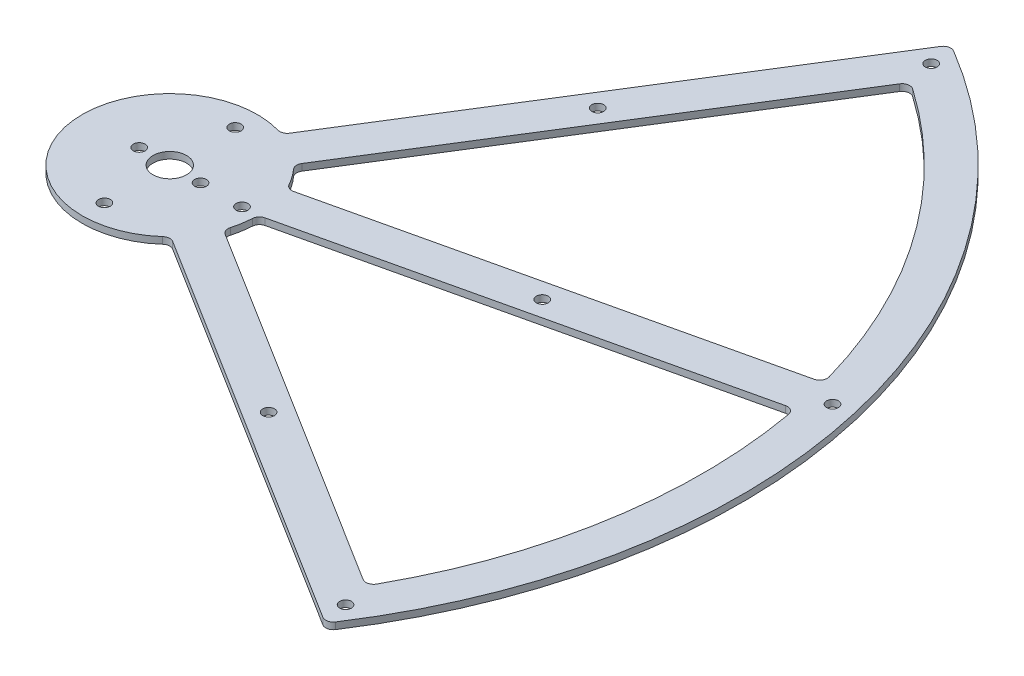
from build123d import *

# Parameters (mm, degrees)
BOSS_EXTRUDE1_DEPTH  = 1.75
MOUNTING_HOLES_REACH = 199.898
SKETCH2_R            = 4.4
SKETCH2_R_2          = 1.55


with BuildPart() as part:
    # Sketch1 → Boss-Extrude1 (new body)
    with BuildSketch(Plane(origin=(0, 0, 0), x_dir=(1, 0, 0), z_dir=(0, 1, 0))):
        with BuildLine():
            Line((8.477821861, 23.002750629), (74.17169656, 128.134926657))
            ThreePointArc((74.17169656, 128.134926657), (75.398161995, 129.019168104), (76.893033195, 128.792319049))
            ThreePointArc((76.893033195, 128.792319049), (146.155509718, 33.742658152), (125.569837037, -82.050082429))
            ThreePointArc((125.569837037, -82.050082429), (124.325699782, -82.909281411), (122.835734015, -82.652177522))
            Line((122.835734015, -82.652177522), (17.703557987, -16.958302822))
            ThreePointArc((17.703557987, -16.958302822), (16.473932566, -16.661618944), (15.312221901, -17.162047094))
            ThreePointArc((15.312221901, -17.162047094), (-22.41051149, -5.17387425), (6.239187615, 22.137582025))
            ThreePointArc((6.239187615, 22.137582025), (7.502699505, 22.197060619), (8.477821861, 23.002750629))
        make_face()
        with BuildLine():
            Line((22.260126283, 10.270675628), (133.165216263, 35.875133138))
            ThreePointArc((133.165216263, 35.875133138), (134.43775302, 36.807406666), (134.638724504, 38.372045344))
            ThreePointArc((134.638724504, 38.372045344), (113.97617257, 81.2984138), (80.115562712, 114.810699028))
            ThreePointArc((80.115562712, 114.810699028), (78.570737863, 115.130073284), (77.274958481, 114.230384713))
            Line((77.274958481, 114.230384713), (16.958302822, 17.703557987))
            ThreePointArc((16.958302822, 17.703557987), (16.661618944, 16.473932566), (17.162047094, 15.312221901))
            ThreePointArc((17.162047094, 15.312221901), (18.724656922, 13.356167981), (20.06540624, 11.241862497))
            ThreePointArc((20.06540624, 11.241862497), (21.000901784, 10.390482389), (22.260126283, 10.270675628))
        make_face(mode=Mode.SUBTRACT)
        with BuildLine():
            Line((24.509636827, 0.52697498), (135.414726806, 26.131432491))
            ThreePointArc((135.414726806, 26.131432491), (136.967157083, 25.851353992), (137.833681508, 24.533166163))
            ThreePointArc((137.833681508, 24.533166163), (138.079984215, -23.10666482), (122.337088578, -68.070821636))
            ThreePointArc((122.337088578, -68.070821636), (121.08861366, -69.035079956), (119.529577356, -68.794477519))
            Line((119.529577356, -68.794477519), (23.002750629, -8.477821861))
            ThreePointArc((23.002750629, -8.477821861), (22.197060619, -7.502699505), (22.137582025, -6.239187615))
            ThreePointArc((22.137582025, -6.239187615), (22.684568835, -3.796094935), (22.96277582, -1.308023937))
            ThreePointArc((22.96277582, -1.308023937), (23.430373171, -0.132714311), (24.509636827, 0.52697498))
        make_face(mode=Mode.SUBTRACT)
    extrude(amount=BOSS_EXTRUDE1_DEPTH)

    # Sketch2 → Mounting_Holes (cut, up to next)
    with BuildSketch(Plane(origin=(0, 1.75, 0), x_dir=(1, 0, 0), z_dir=(0, 1, 0)), mode=Mode.PRIVATE) as mounting_holes_sk1:
        with Locations(Location((0, 0, 0), (0, 0, 270))):
            Circle(SKETCH2_R)
    mounting_holes_tool1 = extrude(mounting_holes_sk1.sketch, amount=-MOUNTING_HOLES_REACH, mode=Mode.PRIVATE) & part.part
    # Sketch2 → Mounting_Holes (cut, up to next)
    with BuildSketch(Plane(origin=(0, 1.75, 0), x_dir=(1, 0, 0), z_dir=(0, 1, 0)), mode=Mode.PRIVATE) as mounting_holes_sk2:
        with Locations(Location((8.064784864, 0, 0), (0, 0, 270))):
            Circle(SKETCH2_R_2)
    mounting_holes_tool2 = extrude(mounting_holes_sk2.sketch, amount=-MOUNTING_HOLES_REACH, mode=Mode.PRIVATE) & part.part
    # Sketch2 → Mounting_Holes (cut, up to next)
    with BuildSketch(Plane(origin=(0, 1.75, 0), x_dir=(1, 0, 0), z_dir=(0, 1, 0)), mode=Mode.PRIVATE) as mounting_holes_sk3:
        with Locations(Location((18.95, 0, 0), (0, 0, 270))):
            Circle(SKETCH2_R_2)
    mounting_holes_tool3 = extrude(mounting_holes_sk3.sketch, amount=-MOUNTING_HOLES_REACH, mode=Mode.PRIVATE) & part.part
    # Sketch2 → Mounting_Holes (cut, up to next)
    with BuildSketch(Plane(origin=(0, 1.75, 0), x_dir=(1, 0, 0), z_dir=(0, 1, 0)), mode=Mode.PRIVATE) as mounting_holes_sk4:
        with Locations(Location((-8.035215136, 0, 0), (0, 0, 270))):
            Circle(SKETCH2_R_2)
    mounting_holes_tool4 = extrude(mounting_holes_sk4.sketch, amount=-MOUNTING_HOLES_REACH, mode=Mode.PRIVATE) & part.part
    # Sketch2 → Mounting_Holes (cut, up to next)
    with BuildSketch(Plane(origin=(0, 1.75, 0), x_dir=(1, 0, 0), z_dir=(0, 1, 0)), mode=Mode.PRIVATE) as mounting_holes_sk5:
        with Locations(Location((0.014784864, 17.15, 0), (0, 0, 270))):
            Circle(SKETCH2_R_2)
    mounting_holes_tool5 = extrude(mounting_holes_sk5.sketch, amount=-MOUNTING_HOLES_REACH, mode=Mode.PRIVATE) & part.part
    # Sketch2 → Mounting_Holes (cut, up to next)
    with BuildSketch(Plane(origin=(0, 1.75, 0), x_dir=(1, 0, 0), z_dir=(0, 1, 0)), mode=Mode.PRIVATE) as mounting_holes_sk6:
        with Locations(Location((-0.014784864, -17.15, 0), (0, 0, 270))):
            Circle(SKETCH2_R_2)
    mounting_holes_tool6 = extrude(mounting_holes_sk6.sketch, amount=-MOUNTING_HOLES_REACH, mode=Mode.PRIVATE) & part.part
    # Sketch2 → Mounting_Holes (cut, up to next)
    with BuildSketch(Plane(origin=(0, 1.75, 0), x_dir=(1, 0, 0), z_dir=(0, 1, 0)), mode=Mode.PRIVATE) as mounting_holes_sk7:
        with Locations(Location((69.115919837, -43.188420035, 0), (0, 0, 270))):
            Circle(SKETCH2_R_2)
    mounting_holes_tool7 = extrude(mounting_holes_sk7.sketch, amount=-MOUNTING_HOLES_REACH, mode=Mode.PRIVATE) & part.part
    # Sketch2 → Mounting_Holes (cut, up to next)
    with BuildSketch(Plane(origin=(0, 1.75, 0), x_dir=(1, 0, 0), z_dir=(0, 1, 0)), mode=Mode.PRIVATE) as mounting_holes_sk8:
        with Locations(Location((122.966973943, -76.838293314, 0), (0, 0, 270))):
            Circle(SKETCH2_R_2)
    mounting_holes_tool8 = extrude(mounting_holes_sk8.sketch, amount=-MOUNTING_HOLES_REACH, mode=Mode.PRIVATE) & part.part
    # Sketch2 → Mounting_Holes (cut, up to next)
    with BuildSketch(Plane(origin=(0, 1.75, 0), x_dir=(1, 0, 0), z_dir=(0, 1, 0)), mode=Mode.PRIVATE) as mounting_holes_sk9:
        with Locations(Location((141.283659394, 32.61790288, 0), (0, 0, 270))):
            Circle(SKETCH2_R_2)
    mounting_holes_tool9 = extrude(mounting_holes_sk9.sketch, amount=-MOUNTING_HOLES_REACH, mode=Mode.PRIVATE) & part.part
    # Sketch2 → Mounting_Holes (cut, up to next)
    with BuildSketch(Plane(origin=(0, 1.75, 0), x_dir=(1, 0, 0), z_dir=(0, 1, 0)), mode=Mode.PRIVATE) as mounting_holes_sk10:
        with Locations(Location((79.41116028, 18.333510929, 0), (0, 0, 270))):
            Circle(SKETCH2_R_2)
    mounting_holes_tool10 = extrude(mounting_holes_sk10.sketch, amount=-MOUNTING_HOLES_REACH, mode=Mode.PRIVATE) & part.part
    # Sketch2 → Mounting_Holes (cut, up to next)
    with BuildSketch(Plane(origin=(0, 1.75, 0), x_dir=(1, 0, 0), z_dir=(0, 1, 0)), mode=Mode.PRIVATE) as mounting_holes_sk11:
        with Locations(Location((43.188420035, 69.115919837, 0), (0, 0, 270))):
            Circle(SKETCH2_R_2)
    mounting_holes_tool11 = extrude(mounting_holes_sk11.sketch, amount=-MOUNTING_HOLES_REACH, mode=Mode.PRIVATE) & part.part
    # Sketch2 → Mounting_Holes (cut, up to next)
    with BuildSketch(Plane(origin=(0, 1.75, 0), x_dir=(1, 0, 0), z_dir=(0, 1, 0)), mode=Mode.PRIVATE) as mounting_holes_sk12:
        with Locations(Location((76.838293314, 122.966973943, 0), (0, 0, 270))):
            Circle(SKETCH2_R_2)
    mounting_holes_tool12 = extrude(mounting_holes_sk12.sketch, amount=-MOUNTING_HOLES_REACH, mode=Mode.PRIVATE) & part.part
    add(mounting_holes_tool1.solids().sort_by_distance((0, 1.75, 0))[0], mode=Mode.SUBTRACT)
    add(mounting_holes_tool2.solids().sort_by_distance((8.064785, 1.75, 0))[0], mode=Mode.SUBTRACT)
    add(mounting_holes_tool3.solids().sort_by_distance((18.95, 1.75, 0))[0], mode=Mode.SUBTRACT)
    add(mounting_holes_tool4.solids().sort_by_distance((-8.035215, 1.75, 0))[0], mode=Mode.SUBTRACT)
    add(mounting_holes_tool5.solids().sort_by_distance((0.014785, 1.75, -17.15))[0], mode=Mode.SUBTRACT)
    add(mounting_holes_tool6.solids().sort_by_distance((-0.014785, 1.75, 17.15))[0], mode=Mode.SUBTRACT)
    add(mounting_holes_tool7.solids().sort_by_distance((69.11592, 1.75, 43.18842))[0], mode=Mode.SUBTRACT)
    add(mounting_holes_tool8.solids().sort_by_distance((122.966974, 1.75, 76.838293))[0], mode=Mode.SUBTRACT)
    add(mounting_holes_tool9.solids().sort_by_distance((141.283659, 1.75, -32.617903))[0], mode=Mode.SUBTRACT)
    add(mounting_holes_tool10.solids().sort_by_distance((79.41116, 1.75, -18.333511))[0], mode=Mode.SUBTRACT)
    add(mounting_holes_tool11.solids().sort_by_distance((43.18842, 1.75, -69.11592))[0], mode=Mode.SUBTRACT)
    add(mounting_holes_tool12.solids().sort_by_distance((76.838293, 1.75, -122.966974))[0], mode=Mode.SUBTRACT)


solid = part.part
